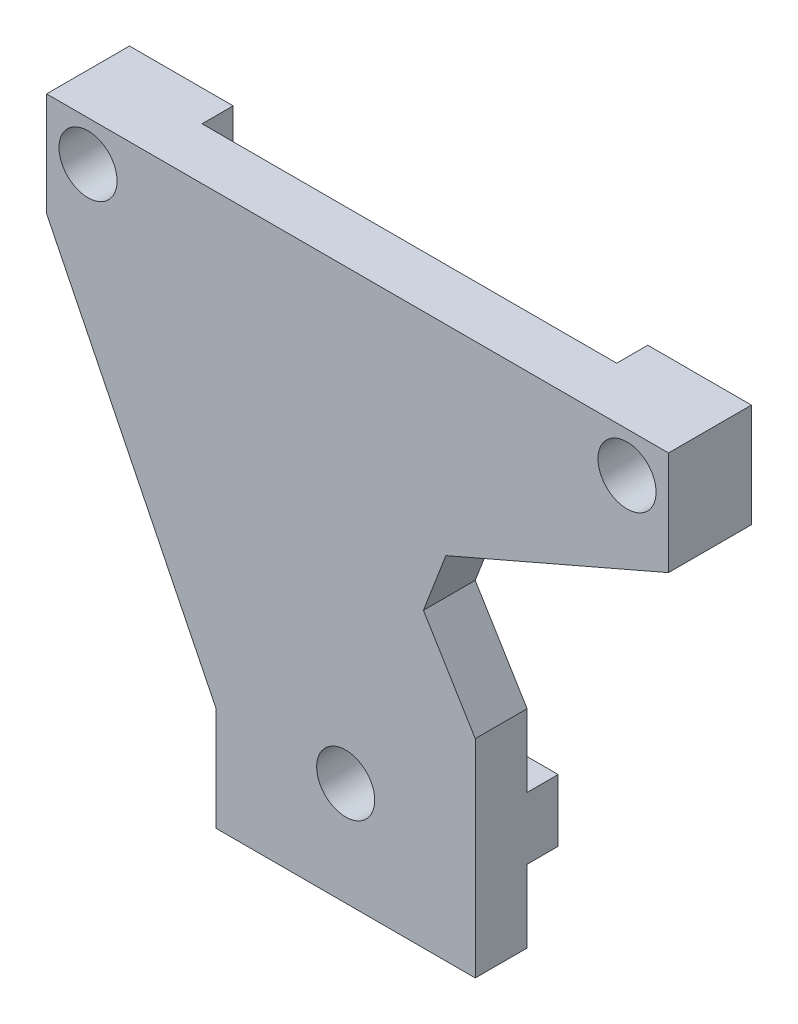
from build123d import *

# Parameters (mm, degrees)
BOSS_EXTRU_1_DEPTH      = 5
ESQUISSE2_W             = 10
ESQUISSE2_H             = 10
ESQUISSE2_W_2           = 25
ESQUISSE2_H_2           = 6
BOSS_EXTRU_2_DEPTH      = 3
ESQUISSE3_R             = 2.8
ENL_V_MAT_EXTRU_3_DEPTH = 8.1


with BuildPart() as part:
    # Esquisse1 → Boss.-Extru.1 (new body)
    with BuildSketch(Plane.XY):
        Polygon((0, 0), (60, 0), (60, -10), (38.522739923, -19.314739888), (36.355716988, -24.967843196), (41.356924968, -33.188115427), (41.356924968, -53.188115427), (16.356924968, -53.188115427), (16.356924968, -43.188115427), (0, -10), align=None)
    extrude(amount=BOSS_EXTRU_1_DEPTH)

    # Esquisse2 → Boss.-Extru.2 (add)
    with BuildSketch(Plane(origin=(0, 0, 0), x_dir=(-1, 0, 0), z_dir=(0, 0, -1))):
        with Locations((-55, -5)):
            Rectangle(ESQUISSE2_W, ESQUISSE2_H)
        with Locations((-5, -5)):
            Rectangle(ESQUISSE2_W, ESQUISSE2_H)
        with Locations((-28.856924968, -43.188115427)):
            Rectangle(ESQUISSE2_W_2, ESQUISSE2_H_2)
    extrude(amount=BOSS_EXTRU_2_DEPTH)

    # Esquisse3 → Enlèv. mat.-Extru.3 (cut)
    with BuildSketch(Plane(origin=(0, 0, -3), x_dir=(-1, 0, 0), z_dir=(0, 0, -1))):
        with Locations((-56, -3.88)):
            Circle(ESQUISSE3_R)
        with Locations((-4, -3.88)):
            Circle(ESQUISSE3_R)
        with Locations((-28.856924968, -43.188115427)):
            Circle(ESQUISSE3_R)
    extrude(amount=-ENL_V_MAT_EXTRU_3_DEPTH, mode=Mode.SUBTRACT)


solid = part.part
